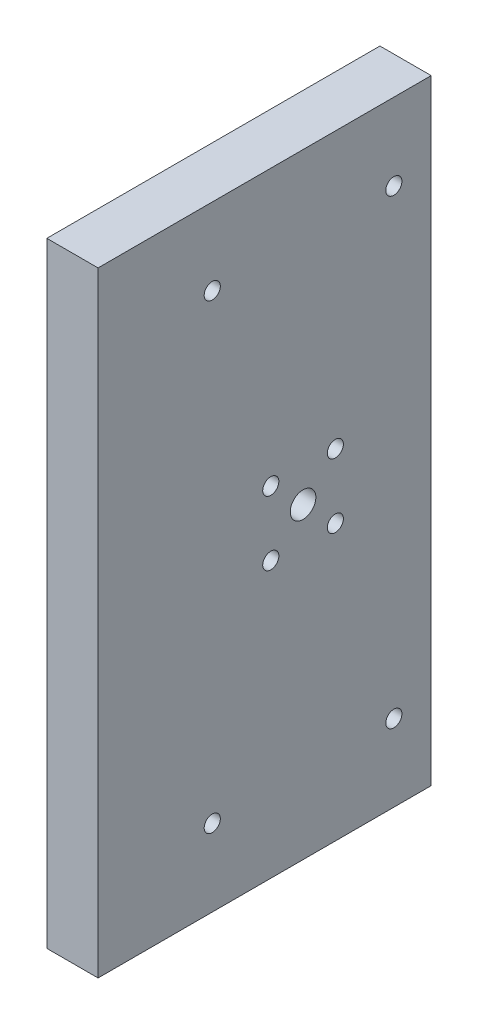
from build123d import *

# Parameters (mm, degrees)
ESQUISSE1_W             = 82.55
ESQUISSE1_H             = 152.4
BOSS_EXTRU_1_DEPTH      = 12.7
ESQUISSE2_R             = 2
ENL_V_MAT_EXTRU_1_DEPTH = 88.586275323
ESQUISSE3_R             = 3.175
ESQUISSE3_R_2           = 2
ENL_V_MAT_EXTRU_2_DEPTH = 88.586275323
ESQUISSE4_R             = 4.7625
ENL_V_MAT_EXTRU_3_DEPTH = 4.7625


with BuildPart() as part:
    # Esquisse1 → Boss.-Extru.1 (new body)
    with BuildSketch(Plane(origin=(0, 0, 0), x_dir=(0, 0, -1), z_dir=(1, 0, 0))):
        Rectangle(ESQUISSE1_W, ESQUISSE1_H)
    extrude(amount=BOSS_EXTRU_1_DEPTH)

    # Esquisse2 → Enlèv. mat.-Extru.1 (cut, through all)
    with BuildSketch(Plane(origin=(12.7, 0, 0), x_dir=(0, 0, -1), z_dir=(1, 0, 0))):
        with Locations((-12.974999958, 57.15)):
            Circle(ESQUISSE2_R)
        with Locations((32.025000042, 57.15)):
            Circle(ESQUISSE2_R)
        with Locations((-12.974999958, -57.15)):
            Circle(ESQUISSE2_R)
        with Locations((32.025000042, -57.15)):
            Circle(ESQUISSE2_R)
    extrude(amount=-ENL_V_MAT_EXTRU_1_DEPTH, mode=Mode.SUBTRACT)

    # Esquisse3 → Enlèv. mat.-Extru.2 (cut, through all)
    with BuildSketch(Plane(origin=(12.7, 0, 0), x_dir=(0, 0, -1), z_dir=(1, 0, 0))):
        with Locations((9.525, 0)):
            Circle(ESQUISSE3_R)
        with Locations((17.525, 8)):
            Circle(ESQUISSE3_R_2)
        with Locations((1.525, 8)):
            Circle(ESQUISSE3_R_2)
        with Locations((1.525, -8)):
            Circle(ESQUISSE3_R_2)
        with Locations((17.525, -8)):
            Circle(ESQUISSE3_R_2)
    extrude(amount=-ENL_V_MAT_EXTRU_2_DEPTH, mode=Mode.SUBTRACT)

    # Esquisse4 → Enlèv. mat.-Extru.3 (cut)
    with BuildSketch(Plane(origin=(0, 0, 0), x_dir=(0, 0, -1), z_dir=(1, 0, 0))):
        with Locations(Location((17.525, 8, 0), (0, 0, 180))):
            Circle(ESQUISSE4_R)
        with Locations(Location((1.525, 8, 0), (0, 0, 180))):
            Circle(ESQUISSE4_R)
        with Locations(Location((1.525, -8, 0), (0, 0, 180))):
            Circle(ESQUISSE4_R)
        with Locations(Location((17.525, -8, 0), (0, 0, 180))):
            Circle(ESQUISSE4_R)
    extrude(amount=ENL_V_MAT_EXTRU_3_DEPTH, mode=Mode.SUBTRACT)


solid = part.part
